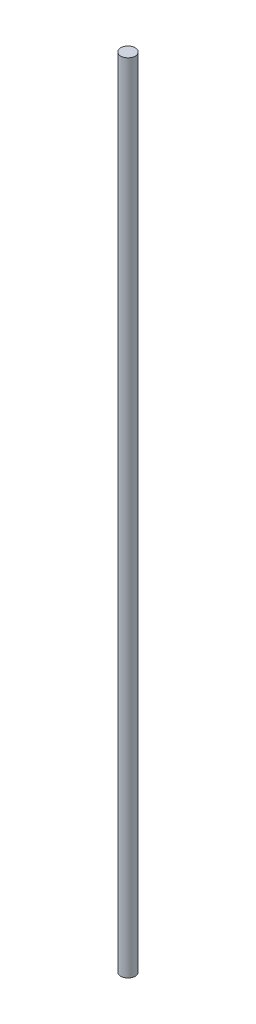
from build123d import *

# Parameters (mm, degrees)
SKETCH1_R           = 5
BOSS_EXTRUDE1_DEPTH = 550


with BuildPart() as part:
    # Sketch1 → Boss-Extrude1 (new body)
    with BuildSketch(Plane(origin=(0, 0, 0), x_dir=(1, 0, 0), z_dir=(0, 1, 0))):
        with Locations(Location((0, 0, 0), (0, 0, 270))):
            Circle(SKETCH1_R)
    extrude(amount=BOSS_EXTRUDE1_DEPTH)


solid = part.part
